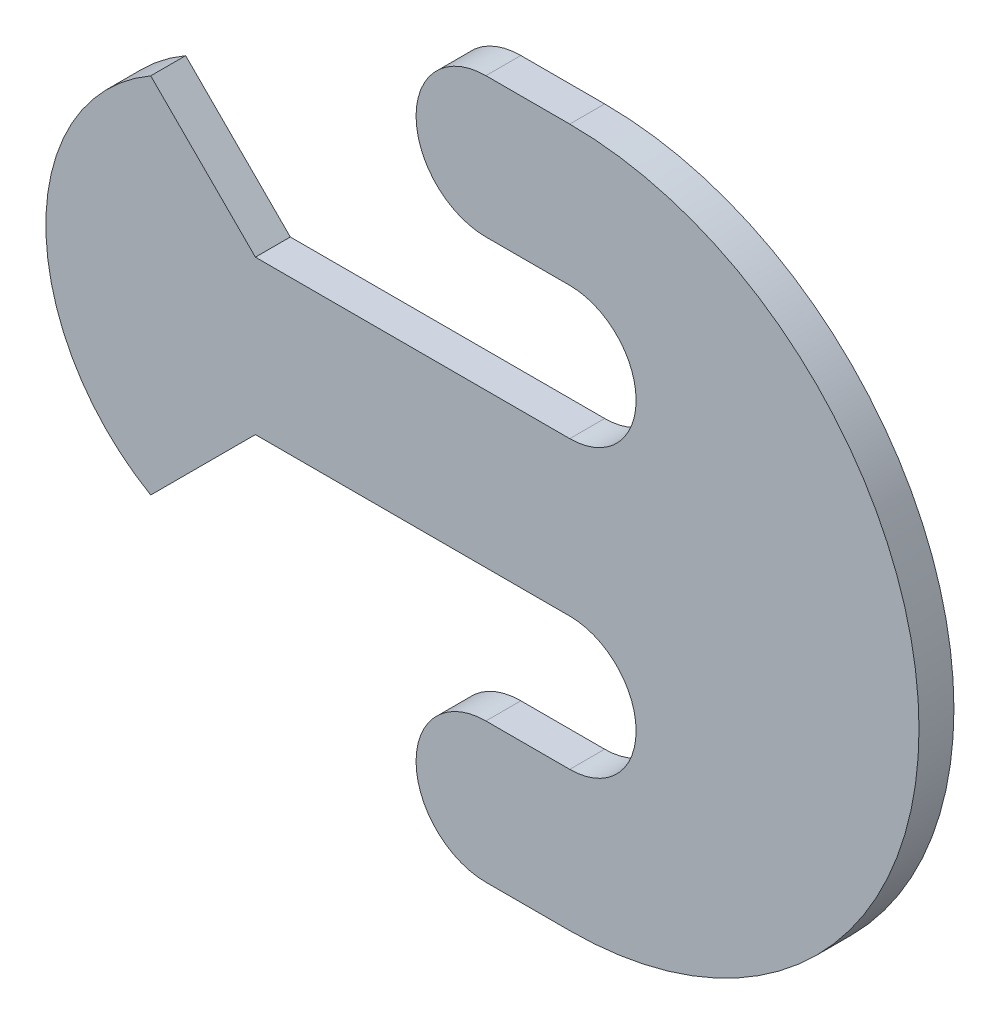
from build123d import *

# Parameters (mm, degrees)
SKETCH1_W           = 45
SKETCH1_H           = 22
BOSS_EXTRUDE1_DEPTH = 5


with BuildPart() as part:
    # Sketch1 → Boss-Extrude1 (new body)
    with BuildSketch(Plane.XY):
        with BuildLine():
            Line((0, 22), (-14.987801249, 36.987801249))
            ThreePointArc((-14.987801249, 36.987801249), (-30, 11), (-14.987801249, -14.987801249))
            Line((-14.987801249, -14.987801249), (0, 0))
            Line((0, 0), (0, 22))
        make_face()
        with Locations((22.5, 11)):
            Rectangle(SKETCH1_W, SKETCH1_H)
        with BuildLine():
            ThreePointArc((45, -19), (54.5, -9.5), (45, 0))
            Line((45, 0), (45, 22))
            ThreePointArc((45, 22), (54.5, 31.5), (45, 41))
            Line((45, 41), (33, 41))
            ThreePointArc((33, 41), (23, 51), (33, 61))
            Line((33, 61), (45, 61))
            ThreePointArc((45, 61), (95, 11), (45, -39))
            Line((45, -39), (33, -39))
            ThreePointArc((33, -39), (23, -29), (33, -19))
            Line((33, -19), (45, -19))
        make_face()
    extrude(amount=BOSS_EXTRUDE1_DEPTH)


solid = part.part
